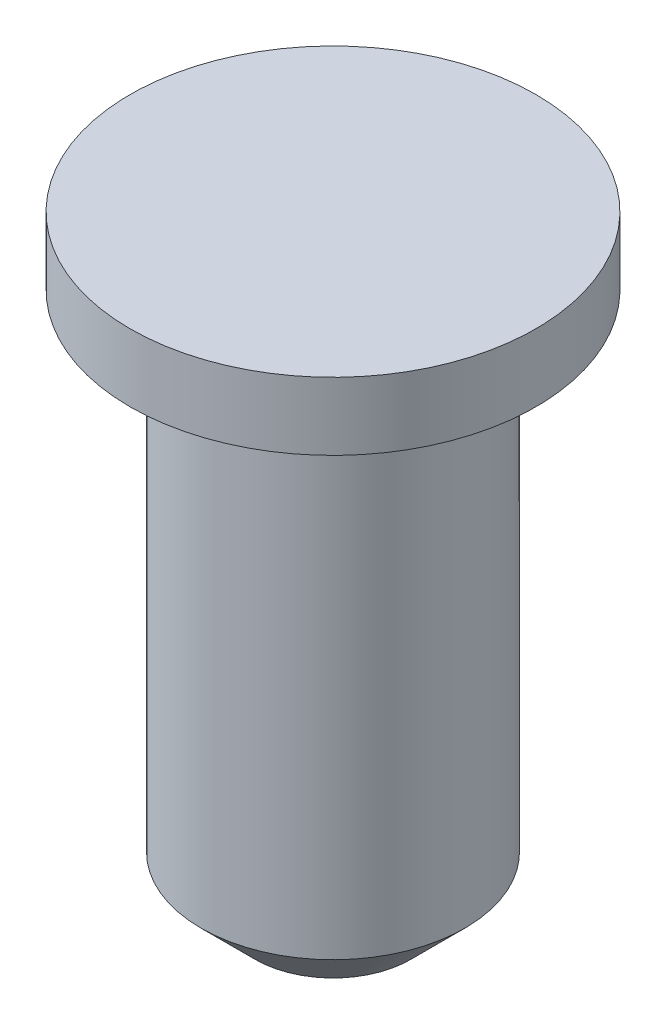
from build123d import *

# Parameters (mm, degrees)
SKETCH1_R           = 1.95
BOSS_EXTRUDE3_DEPTH = 8
SKETCH3_R           = 3
BOSS_EXTRUDE4_DEPTH = 1
CHAMFER1_SIZE       = 0.8


with BuildPart() as part:
    # Sketch1 → Boss-Extrude3 (new body)
    with BuildSketch(Plane(origin=(0, 0, 0), x_dir=(1, 0, 0), z_dir=(0, 1, 0))):
        with Locations(Location((0, 0, 0), (0, 0, 270))):
            Circle(SKETCH1_R)
    extrude(amount=BOSS_EXTRUDE3_DEPTH)

    # Sketch3 → Boss-Extrude4 (add)
    with BuildSketch(Plane(origin=(0, 8, 0), x_dir=(1, 0, 0), z_dir=(0, 1, 0))):
        with Locations(Location((0, 0, 0), (0, 0, 270))):
            Circle(SKETCH3_R)
    extrude(amount=BOSS_EXTRUDE4_DEPTH)

    # Chamfer1
    chamfer1_edges = [part.edges().sort_by_distance(p)[0] for p in [
        (0, 0, -1.95),
    ]]
    chamfer(chamfer1_edges, length=CHAMFER1_SIZE)


solid = part.part
